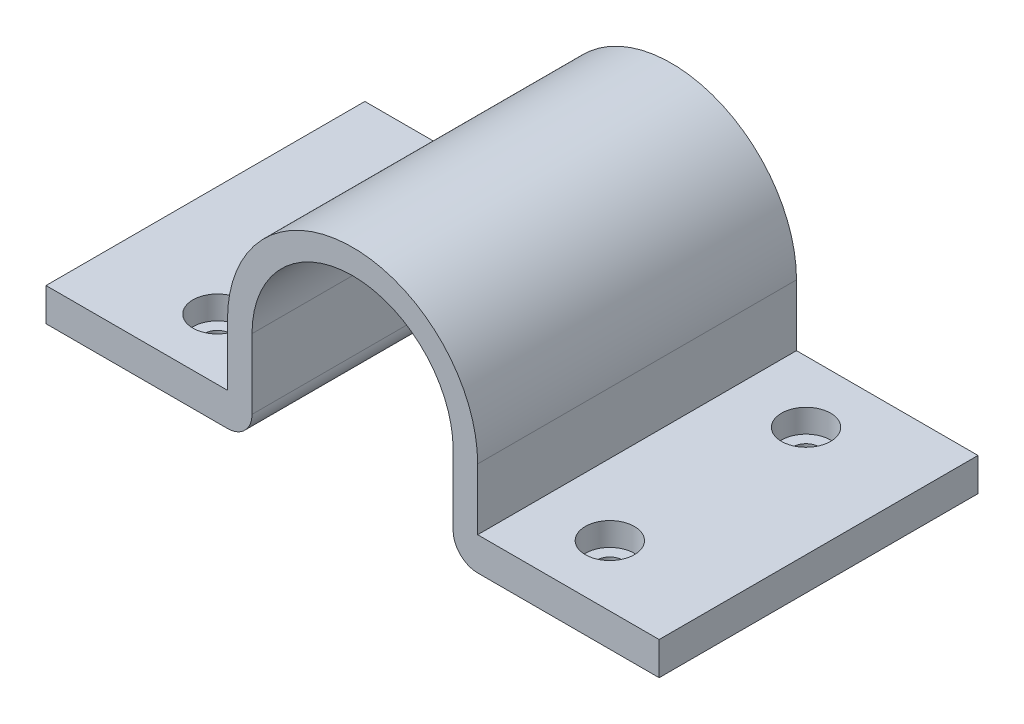
from build123d import *

# Parameters (mm, degrees)
BOSS_EXTRUDE3_DEPTH = 26
SKETCH4_R           = 1.05
CUT_EXTRUDE1_DEPTH  = 40.141282554
SKETCH5_R           = 2
CUT_EXTRUDE2_DEPTH  = 1.9
FILLET2_R           = 2


with BuildPart() as part:
    # Sketch3 → Boss-Extrude3 (new body)
    with BuildSketch(Plane.XY):
        with BuildLine():
            Line((-25, -5), (-25, -7.7))
            Line((-25, -7.7), (-8.2, -7.7))
            Line((-8.2, -7.7), (-8.2, 0))
            ThreePointArc((-8.2, 0), (0, 8.2), (8.2, 0))
            Line((8.2, 0), (8.2, -7.7))
            Line((8.2, -7.7), (25, -7.7))
            Line((25, -7.7), (25, -5))
            Line((25, -5), (10.2, -5))
            Line((10.2, -5), (10.2, 0))
            ThreePointArc((10.2, 0), (0, 10.2), (-10.2, 0))
            Line((-10.2, 0), (-10.2, -5))
            Line((-10.2, -5), (-25, -5))
        make_face()
    extrude(amount=BOSS_EXTRUDE3_DEPTH)

    # Sketch4 → Cut-Extrude1 (cut, through all)
    with BuildSketch(Plane(origin=(0, -5, 0), x_dir=(1, 0, 0), z_dir=(0, 1, 0))):
        with Locations((-16, -5.022119535)):
            Circle(SKETCH4_R)
        with Locations((16, -5.022119535)):
            Circle(SKETCH4_R)
        with Locations((16, -21.022119535)):
            Circle(SKETCH4_R)
        with Locations((-16, -21.022119535)):
            Circle(SKETCH4_R)
    extrude(amount=-CUT_EXTRUDE1_DEPTH, mode=Mode.SUBTRACT)

    # Sketch5 → Cut-Extrude2 (cut)
    with BuildSketch(Plane(origin=(0, -5, 0), x_dir=(1, 0, 0), z_dir=(0, 1, 0))):
        with Locations((-16, -5.022119535)):
            Circle(SKETCH5_R)
        with Locations((16, -5.022119535)):
            Circle(SKETCH5_R)
        with Locations((16, -21.022119535)):
            Circle(SKETCH5_R)
        with Locations((-16, -21.022119535)):
            Circle(SKETCH5_R)
    extrude(amount=-CUT_EXTRUDE2_DEPTH, mode=Mode.SUBTRACT)

    # Fillet2
    fillet2_edges = [part.edges().sort_by_distance(p)[0] for p in [
        (-8.2, -7.7, 13),
        (8.2, -7.7, 13),
    ]]
    fillet(fillet2_edges, radius=FILLET2_R)


solid = part.part
